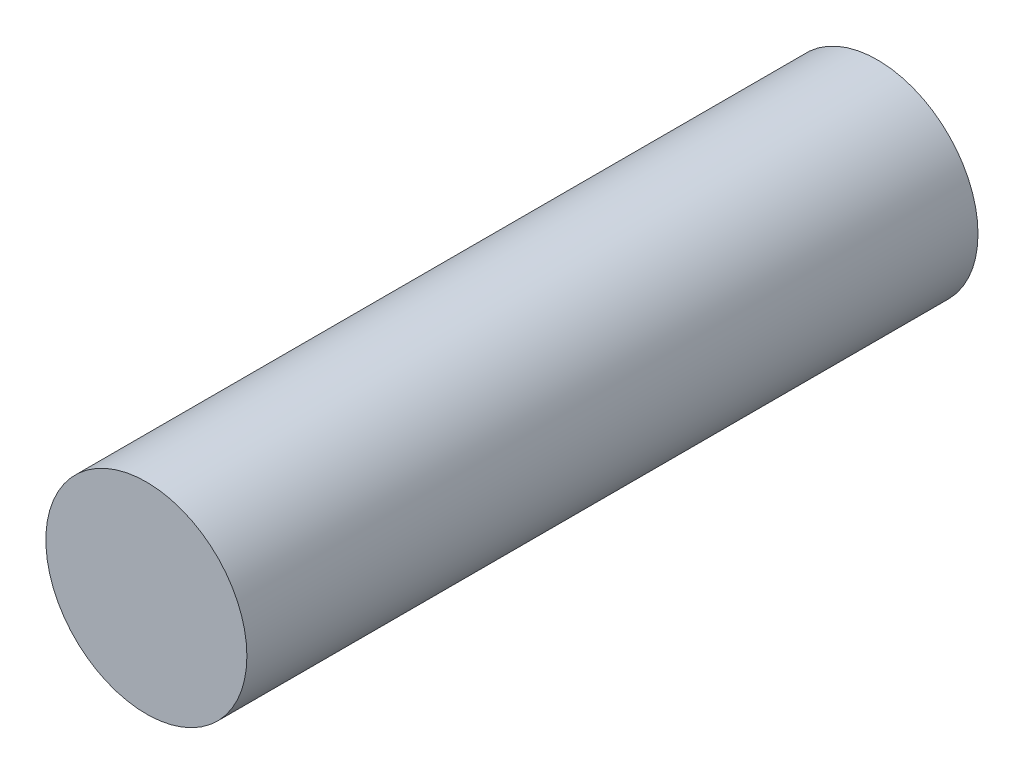
from build123d import *

# Parameters (mm, degrees)
SKETCH1_R           = 5.5
BOSS_EXTRUDE1_DEPTH = 40


with BuildPart() as part:
    # Sketch1 → Boss-Extrude1 (new body)
    with BuildSketch(Plane.XY):
        Circle(SKETCH1_R)
    extrude(amount=BOSS_EXTRUDE1_DEPTH)


solid = part.part
